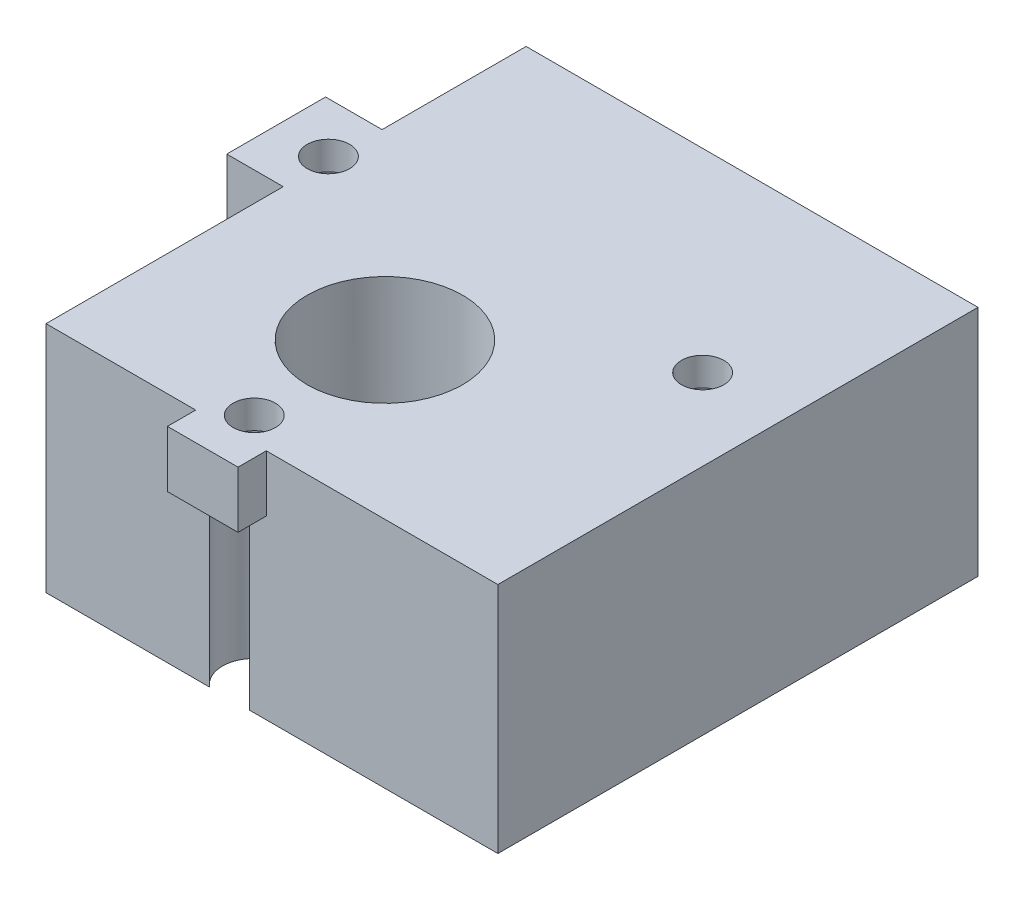
from build123d import *

# Parameters (mm, degrees)
SKETCH_1_W          = 32
SKETCH_1_H          = 34
SKETCH_1_R          = 3.388194149
SKETCH_1_R_2        = 1.2
SKETCH_1_R_3        = 5.5
EXTRUDE_1_DEPTH     = 13.5
EXTRUDE_START       = 3
SKETCH_1_26_R       = 1.2
EXTRUDE_3_DEPTH     = 10.5
EXTRUDE_START_2     = -3
SKETCH_1_25_W       = 32
SKETCH_1_25_H       = 34
SKETCH_1_25_R       = 3.388194149
SKETCH_1_25_R_2     = 1.2
EXTRUDE_2_DEPTH     = 3
SKETCH_2_W          = 4
SKETCH_2_H          = 7
SKETCH_2_W_2        = 5
SKETCH_2_H_2        = 2
EXTRUDE_4_DEPTH     = 4
SKETCH_2_3_R        = 1.5
CUT_EXTRUDE_1_DEPTH = 35.091787867
CUT_EXTRUDE_START   = -16.5
SKETCH_2_4_R        = 2.25
CUT_EXTRUDE_2_DEPTH = 14.5
SKETCH_3_R          = 0.75
CUT_EXTRUDE_3_DEPTH = 4
SKETCH_1_27_R       = 3.388194149
EXTRUDE_5_DEPTH     = 16.5


with BuildPart() as part:
    # 草图1 → 凸台-拉伸1 (new body)
    with BuildSketch(Plane(origin=(0, 0, 0), x_dir=(1, 0, 0), z_dir=(0, 1, 0))):
        with Locations((3, 6)):
            Rectangle(SKETCH_1_W, SKETCH_1_H)
        with Locations(Location((11.473501894, 0, 0), (0, 0, 270))):
            Circle(SKETCH_1_R, mode=Mode.SUBTRACT)
        with Locations(Location((-3.489130435, 11.48154906, 0), (0, 0, 270))):
            Circle(SKETCH_1_R_2, mode=Mode.SUBTRACT)
        with Locations(Location((0, 0, 0), (0, 0, 270))):
            Circle(SKETCH_1_R_3, mode=Mode.SUBTRACT)
    extrude(amount=EXTRUDE_1_DEPTH)

    # 草图1<26> → 凸台-拉伸3 (add)
    with BuildSketch(Plane(origin=(0, 0, 0), x_dir=(1, 0, 0), z_dir=(0, 1, 0)).offset(EXTRUDE_START)):
        with Locations(Location((-3.489130435, 11.48154906, 0), (0, 0, 270))):
            Circle(SKETCH_1_26_R)
    extrude(amount=EXTRUDE_3_DEPTH)

    # 草图1<25> → 凸台-拉伸2 (add)
    with BuildSketch(Plane(origin=(0, 0, 0), x_dir=(1, 0, 0), z_dir=(0, 1, 0)).offset(EXTRUDE_START_2)):
        with Locations((3, 6)):
            Rectangle(SKETCH_1_25_W, SKETCH_1_25_H)
        with Locations(Location((11.473501894, 0, 0), (0, 0, 270))):
            Circle(SKETCH_1_25_R, mode=Mode.SUBTRACT)
        with BuildLine():
            ThreePointArc((5.276856444, 1.550737267), (6.181423335, 0.479588939), (5.452898061, -0.718263692))
            ThreePointArc((5.452898061, -0.718263692), (-1.935120147, -5.148330799), (-4.575965094, 3.051318314))
            ThreePointArc((-4.575965094, 3.051318314), (-5.960597826, 19.614312977), (2.104497703, 5.081445603))
            ThreePointArc((2.104497703, 5.081445603), (4.091157856, 3.67592538), (5.276856444, 1.550737267))
        make_face(mode=Mode.SUBTRACT)
        with Locations(Location((8.010869565, 11.48154906, 0), (0, 0, 270))):
            Circle(SKETCH_1_25_R_2, mode=Mode.SUBTRACT)
    extrude(amount=EXTRUDE_2_DEPTH)

    # 草图2 → 凸台-拉伸4 (add)
    with BuildSketch(Plane(origin=(0, 13.5, 0), x_dir=(1, 0, 0), z_dir=(0, 1, 0))):
        with Locations((-15, 9.3)):
            Rectangle(SKETCH_2_W, SKETCH_2_H)
        with Locations((0.1, -12)):
            Rectangle(SKETCH_2_W_2, SKETCH_2_H_2)
    extrude(amount=-EXTRUDE_4_DEPTH)

    # 草图2<3> → 切除-拉伸1 (cut, through all)
    with BuildSketch(Plane(origin=(0, 13.5, 0), x_dir=(1, 0, 0), z_dir=(0, 1, 0))):
        with Locations(Location((-13.25, 9.25, 0), (0, 0, 270))):
            Circle(SKETCH_2_3_R)
        with Locations(Location((0, -9.25, 0), (0, 0, 270))):
            Circle(SKETCH_2_3_R)
        with Locations(Location((13.25, 9.25, 0), (0, 0, 270))):
            Circle(SKETCH_2_3_R)
    extrude(amount=-CUT_EXTRUDE_1_DEPTH, mode=Mode.SUBTRACT)

    # 草图2<4> → 切除-拉伸2 (cut)
    with BuildSketch(Plane(origin=(0, 13.5, 0), x_dir=(1, 0, 0), z_dir=(0, 1, 0)).offset(CUT_EXTRUDE_START)):
        with Locations(Location((-13.25, 9.25, 0), (0, 0, 83.620629792))):
            Circle(SKETCH_2_4_R)
        with Locations(Location((13.25, 9.25, 0), (0, 0, 270))):
            Circle(SKETCH_2_4_R)
        with Locations(Location((0, -9.25, 0), (0, 0, 308.942441269))):
            Circle(SKETCH_2_4_R)
    extrude(amount=CUT_EXTRUDE_2_DEPTH, mode=Mode.SUBTRACT)

    # 草图3 → 切除-拉伸3 (cut)
    with BuildSketch(Plane.XZ.offset(3)):
        with Locations(Location((-10, 8, 0), (0, 0, 270))):
            Circle(SKETCH_3_R)
        with Locations(Location((17, -21, 0), (0, 0, 270))):
            Circle(SKETCH_3_R)
        with Locations(Location((16, 8, 0), (0, 0, 270))):
            Circle(SKETCH_3_R)
    extrude(amount=-CUT_EXTRUDE_3_DEPTH, mode=Mode.SUBTRACT)

    # 草图1<27> → 凸台-拉伸5 (add, through all)
    with BuildSketch(Plane(origin=(0, 0, 0), x_dir=(1, 0, 0), z_dir=(0, 1, 0)).offset(EXTRUDE_START_2)):
        with Locations((11.473501894, 0)):
            Circle(SKETCH_1_27_R)
    extrude(amount=EXTRUDE_5_DEPTH)


solid = part.part
